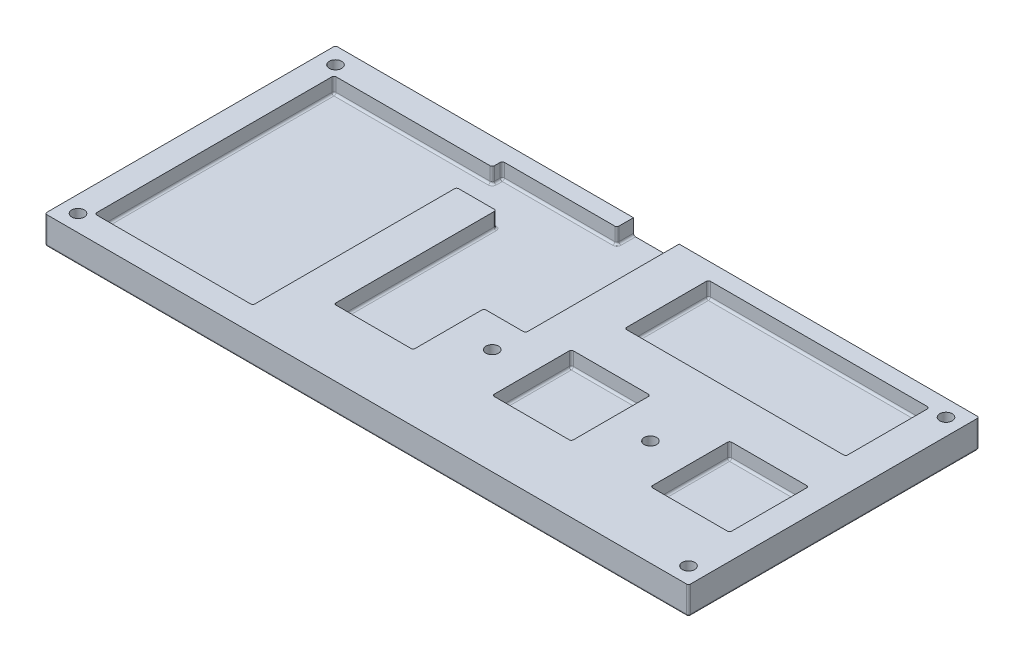
from build123d import *

# Parameters (mm, degrees)
SKETCH1_R           = 1.5
SKETCH1_W           = 19.05
SKETCH1_H           = 19.05
BOSS_EXTRUDE1_DEPTH = 3.75
SKETCH2_W           = 9.525
SKETCH2_H           = 3.75
BOSS_EXTRUDE2_DEPTH = 20
SKETCH3_W           = 17.05
SKETCH3_H           = 3.75
CUT_EXTRUDE1_DEPTH  = 2
SKETCH4_W           = 88.15
SKETCH4_H           = 3.75
BOSS_EXTRUDE3_DEPTH = 4
SKETCH5_W           = 13.325
SKETCH5_H           = 3.75
BOSS_EXTRUDE4_DEPTH = 6
SKETCH6_W           = 19.675
SKETCH6_H           = 3.75
BOSS_EXTRUDE5_DEPTH = 10
SKETCH7_W           = 11
SKETCH7_H           = 3.75
CUT_EXTRUDE2_DEPTH  = 4
SKETCH8_W           = 33
SKETCH8_H           = 3.75
BOSS_EXTRUDE6_DEPTH = 1.0375
SKETCH9_W           = 38.1
SKETCH9_H           = 3.75
CUT_EXTRUDE3_DEPTH  = 0.5
SKETCH10_W          = 52.725
SKETCH10_H          = 3.75
CUT_EXTRUDE4_DEPTH  = 0.5
SKETCH11_W          = 18
SKETCH11_H          = 3.75
CUT_EXTRUDE5_DEPTH  = 0.5
SKETCH13_W          = 14.7
SKETCH13_H          = 3.75
CUT_EXTRUDE6_DEPTH  = 2.175
FILLET1_R           = 0.5
BOSS_EXTRUDE7_START = 3
BOSS_EXTRUDE7_DEPTH = 3
FILLET2_R           = 0.5
FILLET3_R           = 0.5


with BuildPart() as part:
    # Sketch1 → Boss-Extrude1 (new body)
    with BuildSketch(Plane(origin=(0, 0, 0), x_dir=(1, 0, 0), z_dir=(0, 1, 0))):
        with BuildLine():
            ThreePointArc((0, 0.5), (0.146446609, 0.146446609), (0.5, 0))
            Line((0.5, 0), (154.5, 0))
            ThreePointArc((154.5, 0), (154.853553391, 0.146446609), (155, 0.5))
            Line((155, 0.5), (155, 69.5))
            ThreePointArc((155, 69.5), (154.853553391, 69.853553391), (154.5, 70))
            Line((154.5, 70), (132.3125, 70))
            Line((132.3125, 70), (132.3125, 63.825))
            Line((132.3125, 63.825), (146.5125, 63.825))
            Line((146.5125, 63.825), (146.5125, 46.325))
            Line((146.5125, 46.325), (132.3125, 46.325))
            Line((132.3125, 46.325), (91.7875, 46.325))
            Line((91.7875, 46.325), (89.7875, 46.325))
            Line((89.7875, 46.325), (89.7875, 35))
            Line((89.7875, 35), (72.7375, 35))
            Line((72.7375, 35), (72.7375, 15.95))
            Line((72.7375, 15.95), (53.6875, 15.95))
            Line((53.6875, 15.95), (53.6875, 35))
            Line((53.6875, 35), (44.1625, 35))
            Line((44.1625, 35), (44.1625, 6.425))
            Line((44.1625, 6.425), (6.0625, 6.425))
            Line((6.0625, 6.425), (6.0625, 63.575))
            Line((6.0625, 63.575), (44.1625, 63.575))
            Line((44.1625, 63.575), (44.1625, 70))
            Line((44.1625, 70), (0.5, 70))
            ThreePointArc((0.5, 70), (0.146446609, 69.853553391), (0, 69.5))
            Line((0, 69.5), (0, 0.5))
        make_face()
        with Locations(Location((4, 4, 0), (0, 0, 270))):
            Circle(SKETCH1_R, mode=Mode.SUBTRACT)
        with Locations(Location((151, 4, 0), (0, 0, 270))):
            Circle(SKETCH1_R, mode=Mode.SUBTRACT)
        with Locations(Location((82.2625, 25.475, 0), (0, 0, 270))):
            Circle(SKETCH1_R, mode=Mode.SUBTRACT)
        with Locations((101.3125, 25.475)):
            Rectangle(SKETCH1_W, SKETCH1_H, mode=Mode.SUBTRACT)
        with Locations(Location((120.3625, 25.475, 0), (0, 0, 270))):
            Circle(SKETCH1_R, mode=Mode.SUBTRACT)
        with Locations((139.4125, 25.475)):
            Rectangle(SKETCH1_W, SKETCH1_H, mode=Mode.SUBTRACT)
        with Locations(Location((4, 66, 0), (0, 0, 270))):
            Circle(SKETCH1_R, mode=Mode.SUBTRACT)
        with Locations(Location((151, 66, 0), (0, 0, 270))):
            Circle(SKETCH1_R, mode=Mode.SUBTRACT)
    extrude(amount=BOSS_EXTRUDE1_DEPTH)

    # Sketch2 → Boss-Extrude2 (add)
    with BuildSketch(Plane(origin=(0, 0, -35), x_dir=(-1, 0, 0), z_dir=(0, 0, -1))):
        with Locations((-48.925, 1.875)):
            Rectangle(SKETCH2_W, SKETCH2_H)
    extrude(amount=BOSS_EXTRUDE2_DEPTH)

    # Sketch3 → Cut-Extrude1 (cut)
    with BuildSketch(Plane(origin=(0, 0, -35), x_dir=(-1, 0, 0), z_dir=(0, 0, -1))):
        with Locations((-81.2625, 1.875)):
            Rectangle(SKETCH3_W, SKETCH3_H)
    extrude(amount=-CUT_EXTRUDE1_DEPTH, mode=Mode.SUBTRACT)

    # Sketch4 → Boss-Extrude3 (add)
    with BuildSketch(Plane(origin=(0, 0, -70), x_dir=(-1, 0, 0), z_dir=(0, 0, -1))):
        with Locations((-88.2375, 1.875)):
            Rectangle(SKETCH4_W, SKETCH4_H)
    extrude(amount=-BOSS_EXTRUDE3_DEPTH)

    # Sketch5 → Boss-Extrude4 (add)
    with BuildSketch(Plane.ZY.offset(-89.7875)):
        with Locations((-39.6625, 1.875)):
            Rectangle(SKETCH5_W, SKETCH5_H)
    extrude(amount=BOSS_EXTRUDE4_DEPTH)

    # Sketch6 → Boss-Extrude5 (add)
    with BuildSketch(Plane.ZY.offset(-83.7875)):
        with Locations((-56.1625, 1.875)):
            Rectangle(SKETCH6_W, SKETCH6_H)
    extrude(amount=-BOSS_EXTRUDE5_DEPTH)

    # Sketch7 → Cut-Extrude2 (cut)
    with BuildSketch(Plane(origin=(0, 0, -70), x_dir=(-1, 0, 0), z_dir=(0, 0, -1))):
        with Locations((-77.25, 1.875)):
            Rectangle(SKETCH7_W, SKETCH7_H)
    extrude(amount=-CUT_EXTRUDE2_DEPTH, mode=Mode.SUBTRACT)

    # Sketch8 → Boss-Extrude6 (add)
    with BuildSketch(Plane.ZY.offset(-83.7875)):
        with Locations((-49.5, 1.875)):
            Rectangle(SKETCH8_W, SKETCH8_H)
    extrude(amount=BOSS_EXTRUDE6_DEPTH)

    # Sketch9 → Cut-Extrude3 (cut)
    with BuildSketch(Plane(origin=(0, 0, -6.425), x_dir=(-1, 0, 0), z_dir=(0, 0, -1))):
        with Locations((-25.1125, 1.875)):
            Rectangle(SKETCH9_W, SKETCH9_H)
    extrude(amount=-CUT_EXTRUDE3_DEPTH, mode=Mode.SUBTRACT)

    # Sketch10 → Cut-Extrude4 (cut)
    with BuildSketch(Plane(origin=(0, 0, -46.325), x_dir=(-1, 0, 0), z_dir=(0, 0, -1))):
        with Locations((-120.15, 1.875)):
            Rectangle(SKETCH10_W, SKETCH10_H)
    extrude(amount=-CUT_EXTRUDE4_DEPTH, mode=Mode.SUBTRACT)

    # Sketch11 → Cut-Extrude5 (cut)
    with BuildSketch(Plane.ZY.offset(-146.5125)):
        with Locations((-54.825, 1.875)):
            Rectangle(SKETCH11_W, SKETCH11_H)
    extrude(amount=-CUT_EXTRUDE5_DEPTH, mode=Mode.SUBTRACT)

    # Sketch13 → Cut-Extrude6 (cut)
    with BuildSketch(Plane.XY.offset(-63.825)):
        with Locations((139.6625, 1.875)):
            Rectangle(SKETCH13_W, SKETCH13_H)
    extrude(amount=-CUT_EXTRUDE6_DEPTH, mode=Mode.SUBTRACT)

    # Fillet1
    fillet1_edges = [part.edges().sort_by_distance(p)[0] for p in [
        (72.7375, 1.875, -33),
        (129.8875, 1.875, -35),
        (91.7875, 1.875, -35),
        (44.1625, 1.875, -66),
        (93.7875, 1.875, -66),
        (71.75, 1.875, -66),
        (82.75, 1.875, -33),
        (44.1625, 1.875, -5.925),
        (6.0625, 1.875, -5.925),
        (93.7875, 1.875, -45.825),
        (147.0125, 1.875, -45.825),
        (147.0125, 1.875, -66),
        (72.7375, 1.875, -15.95),
        (53.6875, 1.875, -15.95),
        (6.0625, 1.875, -63.575),
        (148.9375, 1.875, -35),
        (148.9375, 1.875, -15.95),
        (129.8875, 1.875, -15.95),
        (53.6875, 1.875, -55),
        (44.1625, 1.875, -55),
        (110.8375, 1.875, -35),
        (110.8375, 1.875, -15.95),
        (91.7875, 1.875, -15.95),
        (44.1625, 1.875, -63.575),
    ]]
    fillet(fillet1_edges, radius=FILLET1_R)

    # Sketch12 → Boss-Extrude7 (add)
    with BuildSketch(Plane.XZ.offset(BOSS_EXTRUDE7_START)):
        with BuildLine():
            Line((155, -0.5), (155, -69.5))
            ThreePointArc((155, -69.5), (154.853553391, -69.853553391), (154.5, -70))
            Line((154.5, -70), (0.5, -70))
            ThreePointArc((0.5, -70), (0.146446609, -69.853553391), (0, -69.5))
            Line((0, -69.5), (0, -0.5))
            ThreePointArc((0, -0.5), (0.146446609, -0.146446609), (0.5, 0))
            Line((0.5, 0), (154.5, 0))
            ThreePointArc((154.5, 0), (154.853553391, -0.146446609), (155, -0.5))
        make_face()
    extrude(amount=-BOSS_EXTRUDE7_DEPTH)

    # Fillet2
    fillet2_edges = [part.edges().sort_by_distance(p)[0] for p in [
        (154.853553391, -3, -0.146446609),
        (77.5, -3, 0),
        (0.146446609, -3, -0.146446609),
        (0, -3, -35),
        (0.146446609, -3, -69.853553391),
        (77.5, -3, -70),
        (154.853553391, -3, -69.853553391),
        (155, -3, -35),
    ]]
    fillet(fillet2_edges, radius=FILLET2_R)

    # Fillet3
    fillet3_edges = [part.edges().sort_by_distance(p)[0] for p in [
        (147.0125, 0, -55.9125),
        (120.4, 0, -66),
        (120.4, 0, -45.825),
        (53.6875, 0, -35.475),
        (63.2125, 0, -15.95),
        (25.1125, 0, -5.925),
        (44.1625, 0, -30.4625),
        (6.0625, 0, -34.75),
        (25.1125, 0, -63.575),
        (48.925, 0, -55),
        (93.7875, 0, -55.9125),
        (72.7375, 0, -24.475),
        (77.74375, 0, -33),
        (82.75, 0, -51.75),
        (71.75, 0, -68.25),
        (57.95625, 0, -66),
        (44.1625, 0, -64.7875),
        (110.8375, 0, -25.475),
        (101.3125, 0, -35),
        (91.7875, 0, -25.475),
        (101.3125, 0, -15.95),
        (148.9375, 0, -25.475),
        (139.4125, 0, -35),
        (129.8875, 0, -25.475),
        (139.4125, 0, -15.95),
        (72.883946609, 0, -32.853553391),
        (71.603553391, 0, -66.146446609),
        (44.016053391, 0, -63.721446609),
        (53.541053391, 0, -54.853553391),
        (44.308946609, 0, -54.853553391),
        (146.866053391, 0, -65.853553391),
        (146.866053391, 0, -45.971446609),
        (53.833946609, 0, -16.096446609),
        (44.016053391, 0, -6.071446609),
        (6.208946609, 0, -6.071446609),
        (6.208946609, 0, -63.428553391),
        (44.308946609, 0, -65.853553391),
        (72.591053391, 0, -16.096446609),
        (82.603553391, 0, -33.146446609),
        (93.933946609, 0, -65.853553391),
        (93.933946609, 0, -45.971446609),
        (91.933946609, 0, -16.096446609),
        (91.933946609, 0, -34.853553391),
        (110.691053391, 0, -16.096446609),
        (110.691053391, 0, -34.853553391),
        (130.033946609, 0, -16.096446609),
        (130.033946609, 0, -34.853553391),
        (148.791053391, 0, -34.853553391),
        (148.791053391, 0, -16.096446609),
    ]]
    fillet(fillet3_edges, radius=FILLET3_R)


solid = part.part
